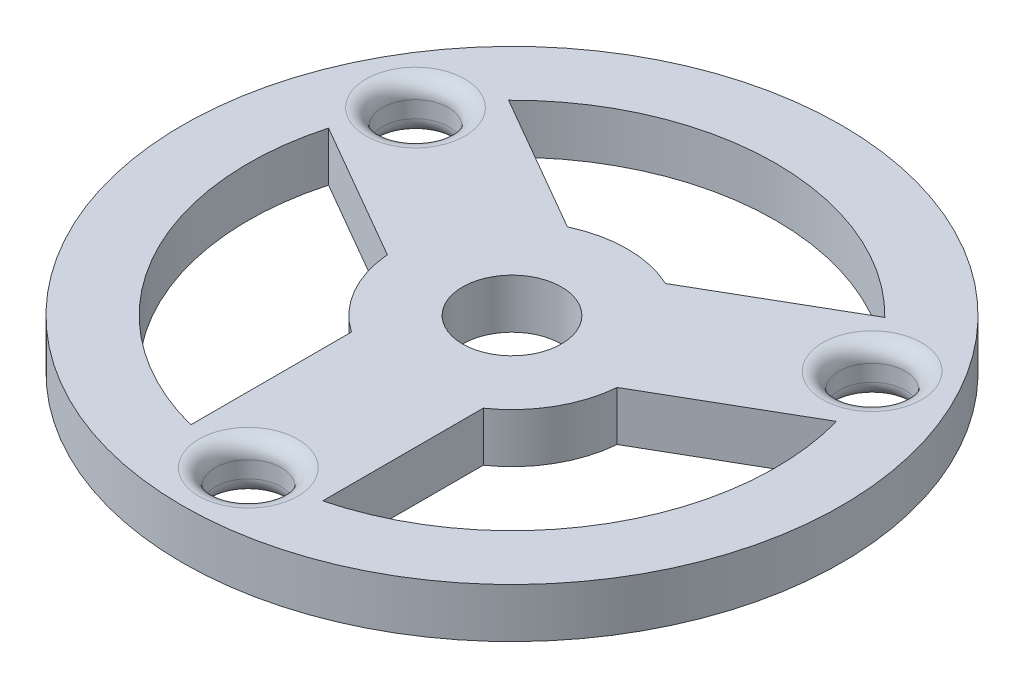
from build123d import *

# Parameters (mm, degrees)
SKETCH1_R           = 10
SKETCH1_R_2         = 1.5
SKETCH1_R_3         = 1
BOSS_EXTRUDE1_DEPTH = 1.5
FILLET1_R           = 0.5


with BuildPart() as part:
    # Sketch1 → Boss-Extrude1 (new body)
    with BuildSketch(Plane(origin=(0, 0, 0), x_dir=(1, 0, 0), z_dir=(0, 1, 0))):
        with Locations(Location((0, 0, 0), (0, 0, 270))):
            Circle(SKETCH1_R)
        with Locations(Location((0, 0, 0), (0, 0, 270))):
            Circle(SKETCH1_R_2, mode=Mode.SUBTRACT)
        with Locations(Location((-6.92820323, 4, 0), (0, 0, 270))):
            Circle(SKETCH1_R_3, mode=Mode.SUBTRACT)
        with Locations(Location((6.92820323, 4, 0), (0, 0, 270))):
            Circle(SKETCH1_R_3, mode=Mode.SUBTRACT)
        with Locations(Location((0, -8, 0), (0, 0, 270))):
            Circle(SKETCH1_R_3, mode=Mode.SUBTRACT)
        with BuildLine():
            Line((-5.708203932, 5.605034154), (-1.487468593, 3.168191469))
            ThreePointArc((-1.487468593, 3.168191469), (0, 3.5), (1.487468593, 3.168191469))
            Line((1.487468593, 3.168191469), (5.708203932, 5.605034154))
            ThreePointArc((5.708203932, 5.605034154), (0, 8), (-5.708203932, 5.605034154))
        make_face(mode=Mode.SUBTRACT)
        with BuildLine():
            Line((2, -2.872281323), (2, -7.745966692))
            ThreePointArc((2, -7.745966692), (6.92820323, -4), (7.708203932, 2.140932539))
            Line((7.708203932, 2.140932539), (3.487468593, -0.295910146))
            ThreePointArc((3.487468593, -0.295910146), (3.031088913, -1.75), (2, -2.872281323))
        make_face(mode=Mode.SUBTRACT)
        with BuildLine():
            Line((-3.487468593, -0.295910146), (-7.708203932, 2.140932539))
            ThreePointArc((-7.708203932, 2.140932539), (-6.92820323, -4), (-2, -7.745966692))
            Line((-2, -7.745966692), (-2, -2.872281323))
            ThreePointArc((-2, -2.872281323), (-3.031088913, -1.75), (-3.487468593, -0.295910146))
        make_face(mode=Mode.SUBTRACT)
    extrude(amount=BOSS_EXTRUDE1_DEPTH)

    # Fillet1
    fillet1_edges = [part.edges().sort_by_distance(p)[0] for p in [
        (6.92820323, 0, -5),
        (6.92820323, 1.5, -5),
        (0, 0, 7),
        (0, 1.5, 7),
        (-6.92820323, 0, -5),
        (-6.92820323, 1.5, -5),
    ]]
    fillet(fillet1_edges, radius=FILLET1_R)


solid = part.part
